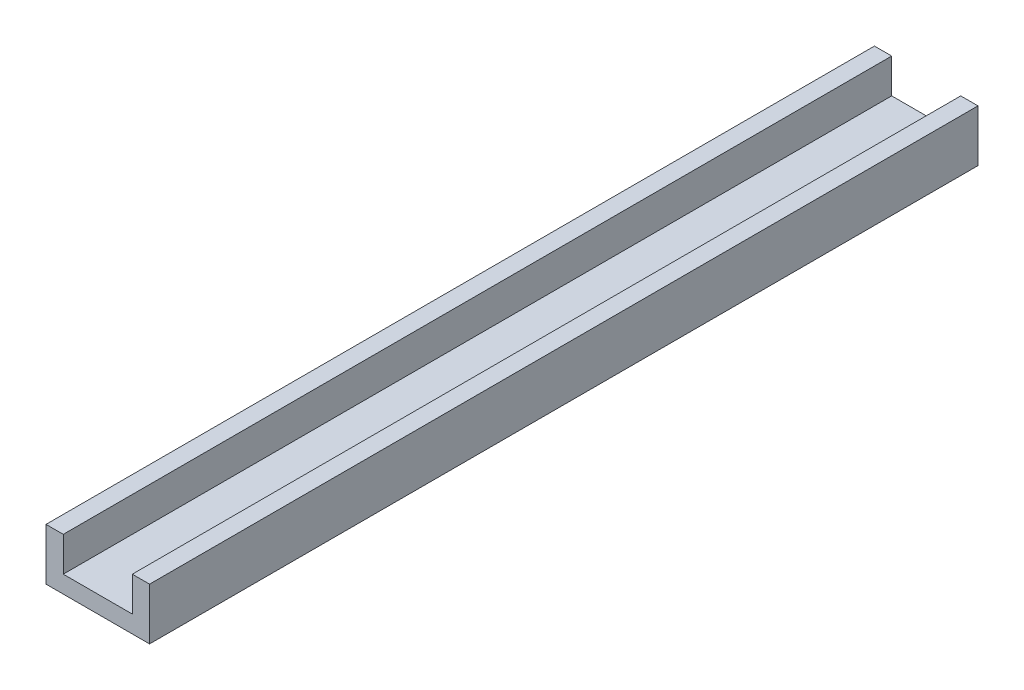
from build123d import *

# Parameters (mm, degrees)
SKETCH1_W           = 38.1
SKETCH1_H           = 19.05
BOSS_EXTRUDE1_DEPTH = 304.8
CUT_EXTRUDE1_REACH  = 309.762
SKETCH2_W           = 25.4
SKETCH2_H           = 12.7


with BuildPart() as part:
    # Sketch1 → Boss-Extrude1 (new body)
    with BuildSketch(Plane.XY):
        with Locations((19.05, 9.525)):
            Rectangle(SKETCH1_W, SKETCH1_H)
    extrude(amount=BOSS_EXTRUDE1_DEPTH)

    # Sketch2 → Cut-Extrude1 (cut, up to next)
    with BuildSketch(Plane.XY.offset(304.8), mode=Mode.PRIVATE) as cut_extrude1_sk1:
        with Locations((19.05, 12.7)):
            Rectangle(SKETCH2_W, SKETCH2_H)
    cut_extrude1_tool1 = extrude(cut_extrude1_sk1.sketch, amount=-CUT_EXTRUDE1_REACH, mode=Mode.PRIVATE) & part.part
    add(cut_extrude1_tool1.solids().sort_by_distance((19.05, 12.7, 304.8))[0], mode=Mode.SUBTRACT)


solid = part.part
